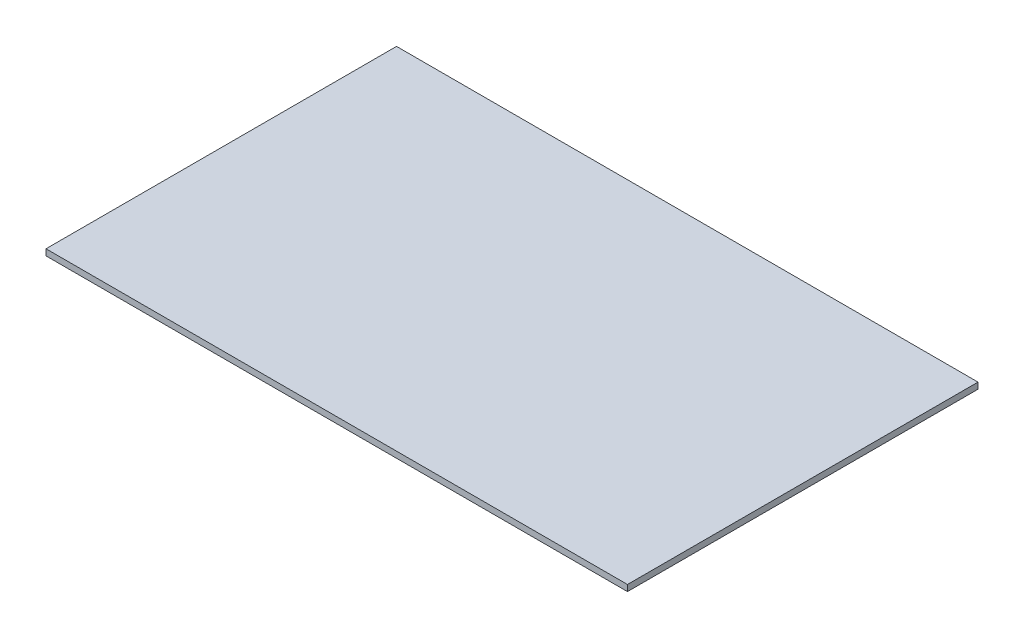
from build123d import *

# Parameters (mm, degrees)
SKETCH1_W           = 282
SKETCH1_H           = 170
BOSS_EXTRUDE1_DEPTH = 1.5


with BuildPart() as part:
    # Sketch1 → Boss-Extrude1 (new, symmetric)
    with BuildSketch(Plane(origin=(0, 0, 0), x_dir=(1, 0, 0), z_dir=(0, 1, 0))):
        Rectangle(SKETCH1_W, SKETCH1_H)
    extrude(amount=BOSS_EXTRUDE1_DEPTH, both=True)


solid = part.part
